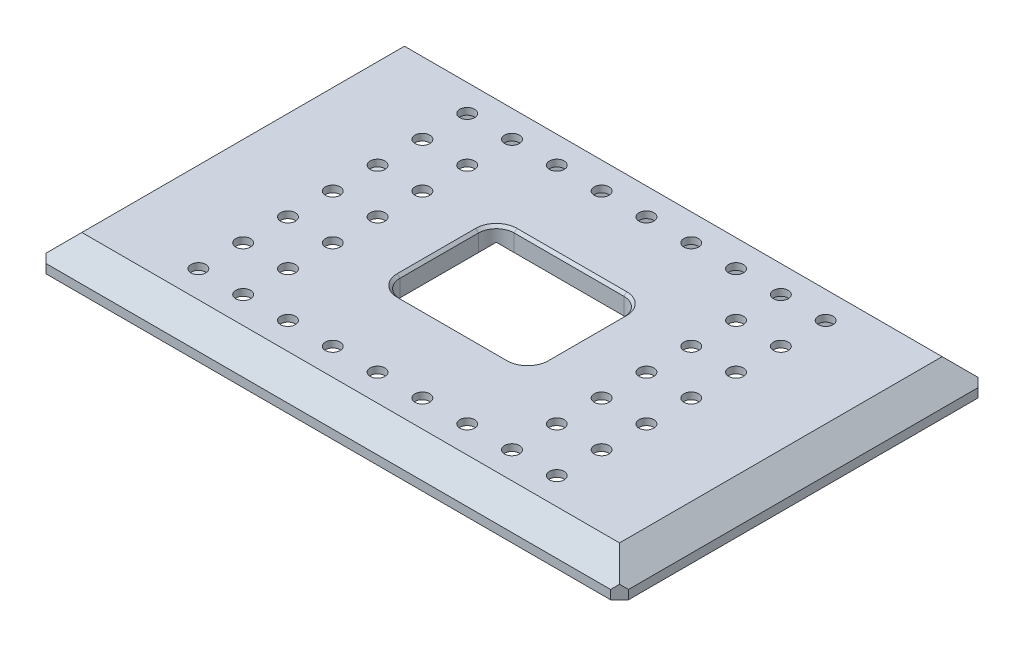
from build123d import *

# Parameters (mm, degrees)
SKETCH1_W           = 130
SKETCH1_H           = 82
BOSS_EXTRUDE1_DEPTH = 2
CHAMFER2_SIZE       = 2
SKETCH4_W           = 8
SKETCH4_H           = 10
BOSS_EXTRUDE2_DEPTH = 7
SKETCH5_R           = 2.05
CUT_EXTRUDE1_DEPTH  = 130.747485656
SKETCH6_W           = 97.8
SKETCH6_H           = 70
CUT_EXTRUDE2_DEPTH  = 5.5
SKETCH7_R           = 1.65
CUT_EXTRUDE3_DEPTH  = 78.860452228
SKETCH10_W          = 50
SKETCH10_H          = 50
BOSS_EXTRUDE3_DEPTH = 1.5
SKETCH11_W          = 45
SKETCH11_H          = 40
BOSS_EXTRUDE4_DEPTH = 3.5
SKETCH12_R          = 1.35
SKETCH12_W          = 32.5
SKETCH12_H          = 25.5
CUT_EXTRUDE4_DEPTH  = 79.115299533
CHAMFER3_SIZE       = 0.6
FILLET1_R           = 4
CHAMFER4_SIZE       = 0.6
SKETCH13_R          = 1.35
BOSS_EXTRUDE5_DEPTH = 1
SKETCH14_R          = 1.8
CUT_EXTRUDE5_DEPTH  = 4
CHAMFER5_SIZE       = 2


with BuildPart() as part:
    # Sketch1 → Boss-Extrude1 (new body)
    with BuildSketch(Plane(origin=(0, 0, 0), x_dir=(1, 0, 0), z_dir=(0, 1, 0))):
        Rectangle(SKETCH1_W, SKETCH1_H)
    extrude(amount=BOSS_EXTRUDE1_DEPTH)

    # Sketch3 → Loft1 section 0
    with BuildSketch(Plane(origin=(0, 7, 0), x_dir=(1, 0, 0), z_dir=(0, 1, 0))):
        with BuildLine():
            Line((-60, -36), (60, -36))
            Line((60, -36), (60, 36))
            Line((60, 36), (-60, 36))
            Line((-60, 36), (-60, -36))
        make_face()
    # Sketch2 → Loft1 section 1
    with BuildSketch(Plane(origin=(0, 2, 0), x_dir=(1, 0, 0), z_dir=(0, 1, 0))):
        with BuildLine():
            Line((65, -41), (65, 41))
            Line((65, 41), (-65, 41))
            Line((-65, 41), (-65, -41))
            Line((-65, -41), (65, -41))
        make_face()
    loft()

    # Chamfer2
    chamfer2_edges = [part.edges().sort_by_distance(p)[0] for p in [
        (65, 1, 41),
        (-65, 1, 41),
        (-65, 1, -41),
        (65, 1, -41),
    ]]
    chamfer(chamfer2_edges, length=CHAMFER2_SIZE)

    # Sketch4 → Boss-Extrude2 (add)
    with BuildSketch(Plane.XZ):
        with Locations((-53.9, 20)):
            Rectangle(SKETCH4_W, SKETCH4_H)
        with Locations((-53.9, -20)):
            Rectangle(SKETCH4_W, SKETCH4_H)
        with Locations((53.9, -20)):
            Rectangle(SKETCH4_W, SKETCH4_H)
        with Locations((53.9, 20)):
            Rectangle(SKETCH4_W, SKETCH4_H)
    extrude(amount=BOSS_EXTRUDE2_DEPTH)

    # Sketch5 → Cut-Extrude1 (cut, through all)
    with BuildSketch(Plane.ZY.offset(57.9)):
        with Locations((-20, -3.5)):
            Circle(SKETCH5_R)
        with Locations((20, -3.5)):
            Circle(SKETCH5_R)
    extrude(amount=-CUT_EXTRUDE1_DEPTH, mode=Mode.SUBTRACT)

    # Sketch6 → Cut-Extrude2 (cut)
    with BuildSketch(Plane.XZ):
        Rectangle(SKETCH6_W, SKETCH6_H)
    extrude(amount=-CUT_EXTRUDE2_DEPTH, mode=Mode.SUBTRACT)

    # Sketch7 → Cut-Extrude3 (cut, through all)
    with BuildSketch(Plane.XZ.offset(-5.5)):
        with Locations(Location((0, 0, 0), (0, 0, 270))):
            Circle(SKETCH7_R)
        with Locations(Location((10, 0, 0), (0, 0, 270))):
            Circle(SKETCH7_R)
        with Locations(Location((20, 0, 0), (0, 0, 270))):
            Circle(SKETCH7_R)
        with Locations(Location((30, 0, 0), (0, 0, 270))):
            Circle(SKETCH7_R)
        with Locations(Location((40, 0, 0), (0, 0, 270))):
            Circle(SKETCH7_R)
        with Locations(Location((10, 10, 0), (0, 0, 270))):
            Circle(SKETCH7_R)
        with Locations(Location((20, 10, 0), (0, 0, 270))):
            Circle(SKETCH7_R)
        with Locations(Location((30, 10, 0), (0, 0, 270))):
            Circle(SKETCH7_R)
        with Locations(Location((40, 10, 0), (0, 0, 270))):
            Circle(SKETCH7_R)
        with Locations(Location((10, 20, 0), (0, 0, 270))):
            Circle(SKETCH7_R)
        with Locations(Location((20, 20, 0), (0, 0, 270))):
            Circle(SKETCH7_R)
        with Locations(Location((30, 20, 0), (0, 0, 270))):
            Circle(SKETCH7_R)
        with Locations(Location((40, 20, 0), (0, 0, 270))):
            Circle(SKETCH7_R)
        with Locations(Location((10, 30, 0), (0, 0, 270))):
            Circle(SKETCH7_R)
        with Locations(Location((20, 30, 0), (0, 0, 270))):
            Circle(SKETCH7_R)
        with Locations(Location((30, 30, 0), (0, 0, 270))):
            Circle(SKETCH7_R)
        with Locations(Location((40, 30, 0), (0, 0, 270))):
            Circle(SKETCH7_R)
        with Locations(Location((0, 10, 0), (0, 0, 270))):
            Circle(SKETCH7_R)
        with Locations(Location((0, 20, 0), (0, 0, 270))):
            Circle(SKETCH7_R)
        with Locations(Location((0, 30, 0), (0, 0, 270))):
            Circle(SKETCH7_R)
        with Locations(Location((-40, 30, 0), (0, 0, 270))):
            Circle(SKETCH7_R)
        with Locations(Location((-30, 30, 0), (0, 0, 270))):
            Circle(SKETCH7_R)
        with Locations(Location((-20, 30, 0), (0, 0, 270))):
            Circle(SKETCH7_R)
        with Locations(Location((-10, 30, 0), (0, 0, 270))):
            Circle(SKETCH7_R)
        with Locations(Location((-40, 20, 0), (0, 0, 270))):
            Circle(SKETCH7_R)
        with Locations(Location((-30, 20, 0), (0, 0, 270))):
            Circle(SKETCH7_R)
        with Locations(Location((-20, 20, 0), (0, 0, 270))):
            Circle(SKETCH7_R)
        with Locations(Location((-10, 20, 0), (0, 0, 270))):
            Circle(SKETCH7_R)
        with Locations(Location((-40, 10, 0), (0, 0, 270))):
            Circle(SKETCH7_R)
        with Locations(Location((-30, 10, 0), (0, 0, 270))):
            Circle(SKETCH7_R)
        with Locations(Location((-20, 10, 0), (0, 0, 270))):
            Circle(SKETCH7_R)
        with Locations(Location((-10, 10, 0), (0, 0, 270))):
            Circle(SKETCH7_R)
        with Locations(Location((-40, 0, 0), (0, 0, 270))):
            Circle(SKETCH7_R)
        with Locations(Location((-30, 0, 0), (0, 0, 270))):
            Circle(SKETCH7_R)
        with Locations(Location((-20, 0, 0), (0, 0, 270))):
            Circle(SKETCH7_R)
        with Locations(Location((-10, 0, 0), (0, 0, 270))):
            Circle(SKETCH7_R)
        with Locations(Location((-10, -10, 0), (0, 0, 270))):
            Circle(SKETCH7_R)
        with Locations(Location((-20, -10, 0), (0, 0, 270))):
            Circle(SKETCH7_R)
        with Locations(Location((-30, -10, 0), (0, 0, 270))):
            Circle(SKETCH7_R)
        with Locations(Location((-40, -10, 0), (0, 0, 270))):
            Circle(SKETCH7_R)
        with Locations(Location((-10, -20, 0), (0, 0, 270))):
            Circle(SKETCH7_R)
        with Locations(Location((-20, -20, 0), (0, 0, 270))):
            Circle(SKETCH7_R)
        with Locations(Location((-30, -20, 0), (0, 0, 270))):
            Circle(SKETCH7_R)
        with Locations(Location((-40, -20, 0), (0, 0, 270))):
            Circle(SKETCH7_R)
        with Locations(Location((-10, -30, 0), (0, 0, 270))):
            Circle(SKETCH7_R)
        with Locations(Location((-20, -30, 0), (0, 0, 270))):
            Circle(SKETCH7_R)
        with Locations(Location((-30, -30, 0), (0, 0, 270))):
            Circle(SKETCH7_R)
        with Locations(Location((-40, -30, 0), (0, 0, 270))):
            Circle(SKETCH7_R)
        with Locations(Location((0, -30, 0), (0, 0, 270))):
            Circle(SKETCH7_R)
        with Locations(Location((0, -20, 0), (0, 0, 270))):
            Circle(SKETCH7_R)
        with Locations(Location((0, -10, 0), (0, 0, 270))):
            Circle(SKETCH7_R)
        with Locations(Location((40, -30, 0), (0, 0, 270))):
            Circle(SKETCH7_R)
        with Locations(Location((30, -30, 0), (0, 0, 270))):
            Circle(SKETCH7_R)
        with Locations(Location((20, -30, 0), (0, 0, 270))):
            Circle(SKETCH7_R)
        with Locations(Location((10, -30, 0), (0, 0, 270))):
            Circle(SKETCH7_R)
        with Locations(Location((40, -20, 0), (0, 0, 270))):
            Circle(SKETCH7_R)
        with Locations(Location((30, -20, 0), (0, 0, 270))):
            Circle(SKETCH7_R)
        with Locations(Location((20, -20, 0), (0, 0, 270))):
            Circle(SKETCH7_R)
        with Locations(Location((10, -20, 0), (0, 0, 270))):
            Circle(SKETCH7_R)
        with Locations(Location((40, -10, 0), (0, 0, 270))):
            Circle(SKETCH7_R)
        with Locations(Location((30, -10, 0), (0, 0, 270))):
            Circle(SKETCH7_R)
        with Locations(Location((20, -10, 0), (0, 0, 270))):
            Circle(SKETCH7_R)
        with Locations(Location((10, -10, 0), (0, 0, 270))):
            Circle(SKETCH7_R)
    extrude(amount=-CUT_EXTRUDE3_DEPTH, mode=Mode.SUBTRACT)

    # Sketch10 → Boss-Extrude3 (add)
    with BuildSketch(Plane(origin=(0, 7, 0), x_dir=(1, 0, 0), z_dir=(0, 1, 0))):
        Rectangle(SKETCH10_W, SKETCH10_H)
    extrude(amount=-BOSS_EXTRUDE3_DEPTH)

    # Sketch11 → Boss-Extrude4 (add)
    with BuildSketch(Plane.XZ.offset(-5.5)):
        Rectangle(SKETCH11_W, SKETCH11_H)
    extrude(amount=BOSS_EXTRUDE4_DEPTH)

    # Sketch12 → Cut-Extrude4 (cut, through all)
    with BuildSketch(Plane(origin=(0, 7, 0), x_dir=(1, 0, 0), z_dir=(0, 1, 0))):
        with Locations(Location((-18.21, 14.785, 0), (0, 0, 270))):
            Circle(SKETCH12_R)
        with Locations(Location((18.21, 14.785, 0), (0, 0, 270))):
            Circle(SKETCH12_R)
        with Locations(Location((18.21, -14.785, 0), (0, 0, 270))):
            Circle(SKETCH12_R)
        with Locations(Location((-18.21, -14.785, 0), (0, 0, 270))):
            Circle(SKETCH12_R)
        Rectangle(SKETCH12_W, SKETCH12_H)
    extrude(amount=-CUT_EXTRUDE4_DEPTH, mode=Mode.SUBTRACT)

    # Chamfer3
    chamfer3_edges = [part.edges().sort_by_distance(p)[0] for p in [
        (0, 2, -12.75),
        (-16.25, 2, 0),
        (0, 2, 12.75),
        (16.25, 2, 0),
    ]]
    chamfer(chamfer3_edges, length=CHAMFER3_SIZE)

    # Fillet1
    fillet1_edges = [part.edges().sort_by_distance(p)[0] for p in [
        (-16.25, 4.8, 12.75),
        (16.25, 4.8, 12.75),
        (16.25, 4.8, -12.75),
        (-16.25, 4.8, -12.75),
    ]]
    fillet(fillet1_edges, radius=FILLET1_R)

    # Chamfer4
    chamfer4_edges = [part.edges().sort_by_distance(p)[0] for p in [
        (16.25, 7, 0),
        (0, 7, 12.75),
        (-16.25, 7, 0),
        (0, 7, -12.75),
        (15.078427125, 7, 11.578427125),
        (-15.078427125, 7, 11.578427125),
        (15.078427125, 7, -11.578427125),
        (-15.078427125, 7, -11.578427125),
    ]]
    chamfer(chamfer4_edges, length=CHAMFER4_SIZE)

    # Sketch13 → Boss-Extrude5 (add)
    with BuildSketch(Plane(origin=(0, 7, 0), x_dir=(1, 0, 0), z_dir=(0, 1, 0))):
        with Locations(Location((-18.21, -14.785, 0), (0, 0, 270))):
            Circle(SKETCH13_R)
        with Locations(Location((18.21, -14.785, 0), (0, 0, 270))):
            Circle(SKETCH13_R)
        with Locations(Location((18.21, 14.785, 0), (0, 0, 270))):
            Circle(SKETCH13_R)
        with Locations(Location((-18.21, 14.785, 0), (0, 0, 270))):
            Circle(SKETCH13_R)
    extrude(amount=-BOSS_EXTRUDE5_DEPTH)

    # Sketch14 → Cut-Extrude5 (cut)
    with BuildSketch(Plane.XZ.offset(-2)):
        with Locations(Location((-18.21, 14.785, 0), (0, 0, 270))):
            Circle(SKETCH14_R)
        with Locations(Location((18.21, 14.785, 0), (0, 0, 270))):
            Circle(SKETCH14_R)
        with Locations(Location((18.21, -14.785, 0), (0, 0, 270))):
            Circle(SKETCH14_R)
        with Locations(Location((-18.21, -14.785, 0), (0, 0, 270))):
            Circle(SKETCH14_R)
    extrude(amount=-CUT_EXTRUDE5_DEPTH, mode=Mode.SUBTRACT)

    # Chamfer5
    chamfer5_edges = [part.edges().sort_by_distance(p)[0] for p in [
        (22.5, 2, 0),
        (0, 2, 20),
        (-22.5, 2, 0),
        (0, 2, -20),
    ]]
    chamfer(chamfer5_edges, length=CHAMFER5_SIZE)


solid = part.part
